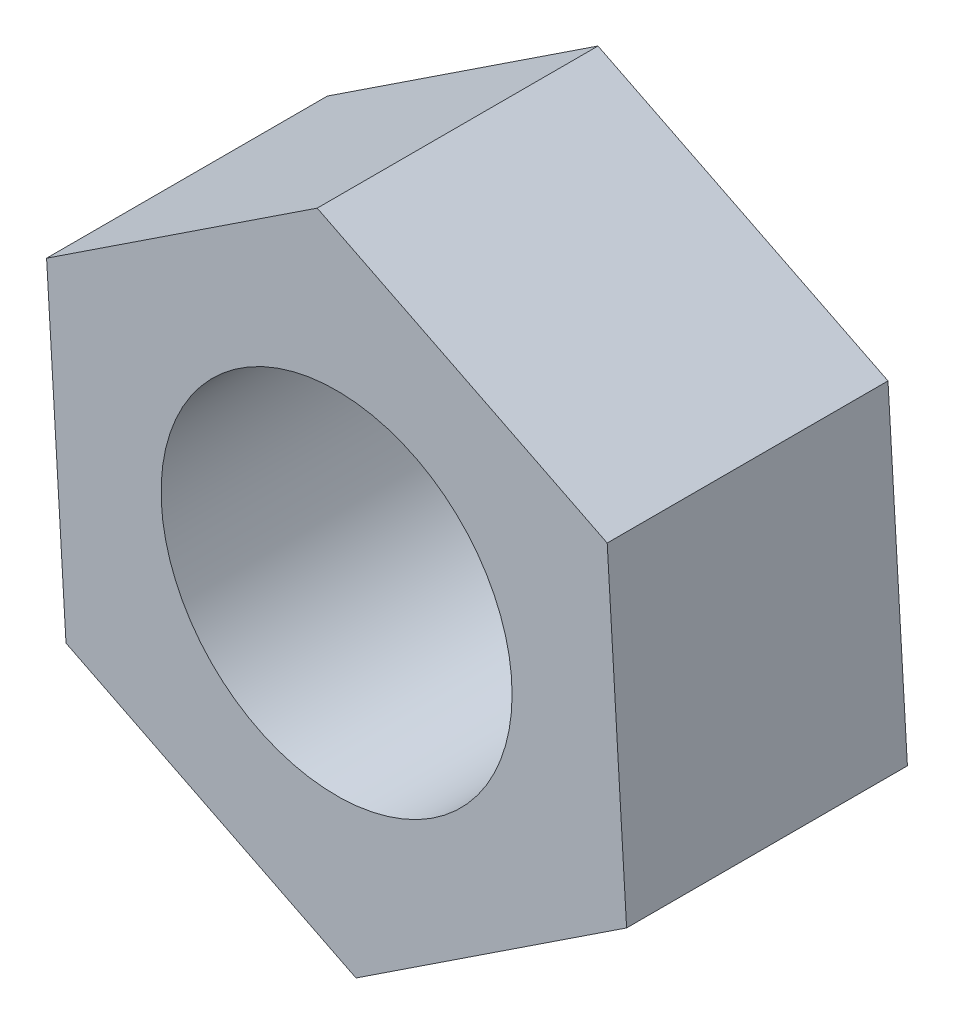
from build123d import *

# Parameters (mm, degrees)
BOSS_EXTRUDE1_DEPTH = 4
SKETCH2_R           = 2.5
CUT_EXTRUDE1_DEPTH  = 10


with BuildPart() as part:
    # Sketch1 → Boss-Extrude1 (new body)
    with BuildSketch(Plane.XY):
        Polygon((3.8546064, 2.544669494), (-0.276445226, 4.610521811), (-4.131051626, 2.065852317), (-3.8546064, -2.544669494), (0.276445226, -4.610521811), (4.131051626, -2.065852317), align=None)
    extrude(amount=BOSS_EXTRUDE1_DEPTH)

    # Sketch2 → Cut-Extrude1 (cut)
    with BuildSketch(Plane.XY.offset(4)):
        Circle(SKETCH2_R)
    extrude(amount=-CUT_EXTRUDE1_DEPTH, mode=Mode.SUBTRACT)


solid = part.part
